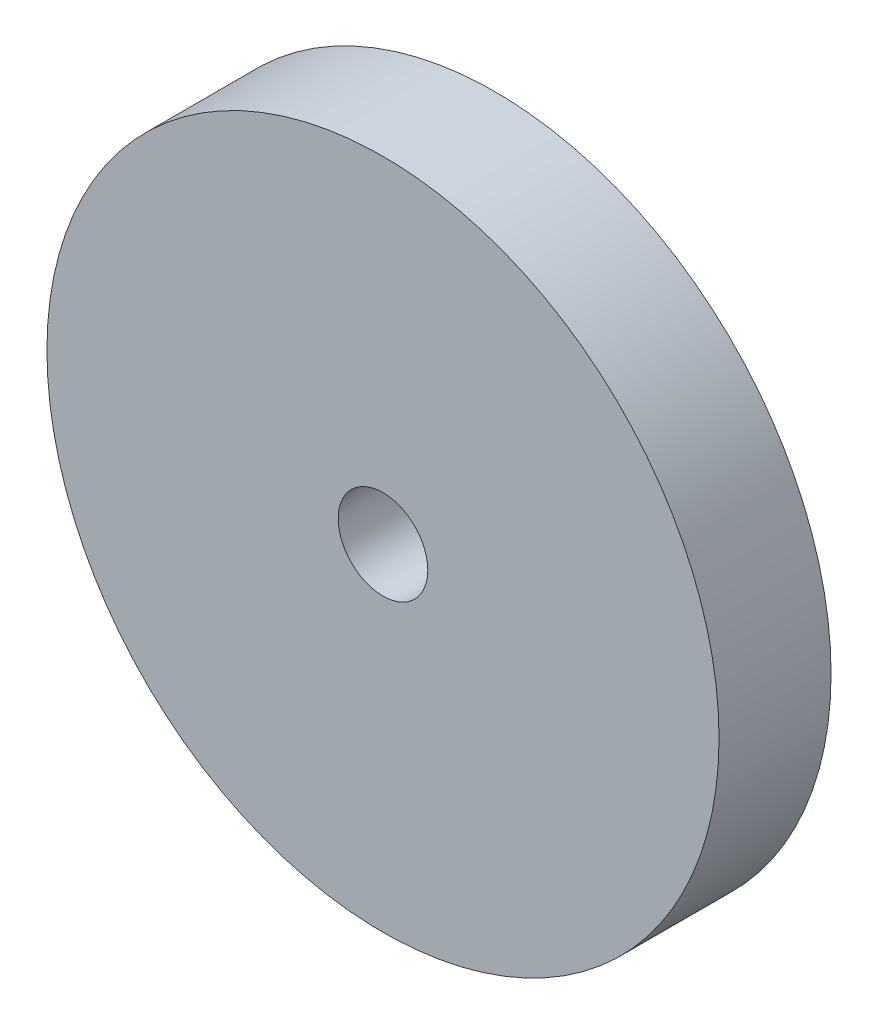
from build123d import *

# Parameters (mm, degrees)
CROQUIS1_R              = 15
SALIENTE_EXTRUIR1_DEPTH = 5
CROQUIS2_R              = 2
CORTAR_EXTRUIR1_DEPTH   = 5


with BuildPart() as part:
    # Croquis1 → Saliente-Extruir1 (new body)
    with BuildSketch(Plane.XY):
        Circle(CROQUIS1_R)
    extrude(amount=SALIENTE_EXTRUIR1_DEPTH)

    # Croquis2 → Cortar-Extruir1 (cut)
    with BuildSketch(Plane.XY.offset(5)):
        Circle(CROQUIS2_R)
    extrude(amount=-CORTAR_EXTRUIR1_DEPTH, mode=Mode.SUBTRACT)


solid = part.part
